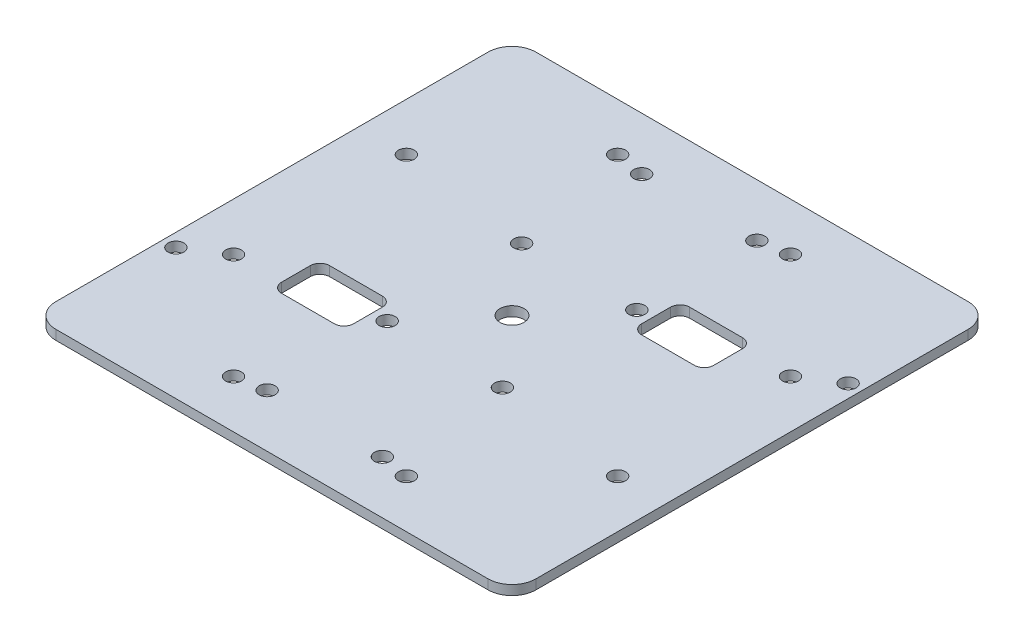
from build123d import *

# Parameters (mm, degrees)
SKETCH_1_W               = 100
SKETCH_1_H               = 100
EXTRUDE_1_DEPTH          = 2
CUT_EXTRUDE_436_REACH    = 72.739
SKETCH_2_R               = 2.5
CUT_EXTRUDE_2_REACH      = 72.739
SKETCH_3_R               = 1.65
PATTERN_LINEAR_1_COUNT   = 2
PATTERN_LINEAR_1_PITCH   = 25
MIRROR_1_COPY_1_REACH    = 72.739
MIRROR_1_COPY_1_SKETCH_R = 1.65
CUT_EXTRUDE_3_REACH      = 72.739
SKETCH_5_R               = 1.65
PATTERN_CIRCULAR_1_COUNT = 2
CUT_EXTRUDE_4_REACH      = 72.739
SKETCH_6_R               = 1.65
PATTERN_CIRCULAR_2_COUNT = 2
PATTERN_CIRCULAR_2_ANGLE = 90
CUT_EXTRUDE_5_REACH      = 72.739
SKETCH_7_W               = 15
SKETCH_7_H               = 10
FILLET_1_R               = 2
FILLET_2_R               = 5


with BuildPart() as part:
    # 草图1 → 凸台-拉伸1 (new body)
    with BuildSketch(Plane(origin=(0, 0, 0), x_dir=(1, 0, 0), z_dir=(0, 1, 0))):
        Rectangle(SKETCH_1_W, SKETCH_1_H)
    extrude(amount=EXTRUDE_1_DEPTH)

    # 草图2 → Cut-Extrude 436 (cut, up to next)
    with BuildSketch(Plane(origin=(0, 2, 0), x_dir=(1, 0, 0), z_dir=(0, 1, 0)), mode=Mode.PRIVATE) as cut_extrude_436_sk1:
        with Locations(Location((0, 0, 0), (0, 0, 270))):
            Circle(SKETCH_2_R)
    cut_extrude_436_tool1 = extrude(cut_extrude_436_sk1.sketch, amount=-CUT_EXTRUDE_436_REACH, mode=Mode.PRIVATE) & part.part
    add(cut_extrude_436_tool1.solids().sort_by_distance((0, 2, 0))[0], mode=Mode.SUBTRACT)

    # 草图3 → 切除-拉伸2 (cut, up to next)
    with BuildSketch(Plane(origin=(0, 2, 0), x_dir=(1, 0, 0), z_dir=(0, 1, 0)), mode=Mode.PRIVATE) as cut_extrude_2_sk1:
        with Locations(Location((-12, 39, 0), (0, 0, 270))):
            Circle(SKETCH_3_R)
    cut_extrude_2_tool1 = extrude(cut_extrude_2_sk1.sketch, amount=-CUT_EXTRUDE_2_REACH, mode=Mode.PRIVATE) & part.part
    # 草图3 → 切除-拉伸2 (cut, up to next)
    with BuildSketch(Plane(origin=(0, 2, 0), x_dir=(1, 0, 0), z_dir=(0, 1, 0)), mode=Mode.PRIVATE) as cut_extrude_2_sk2:
        with Locations(Location((12, 39, 0), (0, 0, 270))):
            Circle(SKETCH_3_R)
    cut_extrude_2_tool2 = extrude(cut_extrude_2_sk2.sketch, amount=-CUT_EXTRUDE_2_REACH, mode=Mode.PRIVATE) & part.part
    cut_extrude_2_1 = cut_extrude_2_tool1.solids().sort_by_distance((-12, 2, -39))[0]
    add(cut_extrude_2_1, mode=Mode.SUBTRACT)
    cut_extrude_2_2 = cut_extrude_2_tool2.solids().sort_by_distance((12, 2, -39))[0]
    add(cut_extrude_2_2, mode=Mode.SUBTRACT)
    cut_extrude_2 = cut_extrude_2_1 + cut_extrude_2_2  # 切除-拉伸2 as one shape, for the pattern or mirror that repeats it

    # 阵列(线性)1: 切除-拉伸2 ×2
    with Locations(*[(0, 0, i * PATTERN_LINEAR_1_PITCH) for i in range(1, PATTERN_LINEAR_1_COUNT)]):
        add(cut_extrude_2, mode=Mode.SUBTRACT)

    # 镜向1: 切除-拉伸2 across plane
    add(cut_extrude_2.mirror(Plane.XY), mode=Mode.SUBTRACT)

    # 镜向1 copy 1 sketch → 镜向1 copy 1 (cut, up to next)
    with BuildSketch(Plane(origin=(0, 2, -25), x_dir=(1, 0, 0), z_dir=(0, 1, 0)), mode=Mode.PRIVATE) as mirror_1_copy_1_sk1:
        with Locations((-12, -39)):
            Circle(MIRROR_1_COPY_1_SKETCH_R)
    mirror_1_copy_1_tool1 = extrude(mirror_1_copy_1_sk1.sketch, amount=-MIRROR_1_COPY_1_REACH, mode=Mode.PRIVATE) & part.part
    # 镜向1 copy 1 sketch → 镜向1 copy 1 (cut, up to next)
    with BuildSketch(Plane(origin=(0, 2, -25), x_dir=(1, 0, 0), z_dir=(0, 1, 0)), mode=Mode.PRIVATE) as mirror_1_copy_1_sk2:
        with Locations((12, -39)):
            Circle(MIRROR_1_COPY_1_SKETCH_R)
    mirror_1_copy_1_tool2 = extrude(mirror_1_copy_1_sk2.sketch, amount=-MIRROR_1_COPY_1_REACH, mode=Mode.PRIVATE) & part.part
    add(mirror_1_copy_1_tool1.solids().sort_by_distance((-12, 2, 14))[0], mode=Mode.SUBTRACT)
    add(mirror_1_copy_1_tool2.solids().sort_by_distance((12, 2, 14))[0], mode=Mode.SUBTRACT)

    # 草图5 → 切除-拉伸3 (cut, up to next)
    with BuildSketch(Plane(origin=(0, 2, 0), x_dir=(1, 0, 0), z_dir=(0, 1, 0)), mode=Mode.PRIVATE) as cut_extrude_3_sk1:
        with Locations(Location((47.25, 22.75, 0), (0, 0, 270))):
            Circle(SKETCH_5_R)
    cut_extrude_3_tool1 = extrude(cut_extrude_3_sk1.sketch, amount=-CUT_EXTRUDE_3_REACH, mode=Mode.PRIVATE) & part.part
    cut_extrude_3 = cut_extrude_3_tool1.solids().sort_by_distance((47.25, 2, -22.75))[0]
    add(cut_extrude_3, mode=Mode.SUBTRACT)

    # 阵列(圆周)1: 切除-拉伸3 ×2 about axis
    pattern_circular_1_axis = Axis((0, 0, 0), (0, 1, 0))
    for i in range(1, PATTERN_CIRCULAR_1_COUNT):
        add(cut_extrude_3.rotate(pattern_circular_1_axis, i * 360 / PATTERN_CIRCULAR_1_COUNT), mode=Mode.SUBTRACT)

    # 草图6 → 切除-拉伸4 (cut, up to next)
    with BuildSketch(Plane(origin=(0, 2, 0), x_dir=(1, 0, 0), z_dir=(0, 1, 0)), mode=Mode.PRIVATE) as cut_extrude_4_sk1:
        with Locations(Location((-40, 18, 0), (0, 0, 270))):
            Circle(SKETCH_6_R)
    cut_extrude_4_tool1 = extrude(cut_extrude_4_sk1.sketch, amount=-CUT_EXTRUDE_4_REACH, mode=Mode.PRIVATE) & part.part
    # 草图6 → 切除-拉伸4 (cut, up to next)
    with BuildSketch(Plane(origin=(0, 2, 0), x_dir=(1, 0, 0), z_dir=(0, 1, 0)), mode=Mode.PRIVATE) as cut_extrude_4_sk2:
        with Locations(Location((-40, -18, 0), (0, 0, 270))):
            Circle(SKETCH_6_R)
    cut_extrude_4_tool2 = extrude(cut_extrude_4_sk2.sketch, amount=-CUT_EXTRUDE_4_REACH, mode=Mode.PRIVATE) & part.part
    # 草图6 → 切除-拉伸4 (cut, up to next)
    with BuildSketch(Plane(origin=(0, 2, 0), x_dir=(1, 0, 0), z_dir=(0, 1, 0)), mode=Mode.PRIVATE) as cut_extrude_4_sk3:
        with Locations(Location((40, -18, 0), (0, 0, 270))):
            Circle(SKETCH_6_R)
    cut_extrude_4_tool3 = extrude(cut_extrude_4_sk3.sketch, amount=-CUT_EXTRUDE_4_REACH, mode=Mode.PRIVATE) & part.part
    # 草图6 → 切除-拉伸4 (cut, up to next)
    with BuildSketch(Plane(origin=(0, 2, 0), x_dir=(1, 0, 0), z_dir=(0, 1, 0)), mode=Mode.PRIVATE) as cut_extrude_4_sk4:
        with Locations(Location((40, 18, 0), (0, 0, 270))):
            Circle(SKETCH_6_R)
    cut_extrude_4_tool4 = extrude(cut_extrude_4_sk4.sketch, amount=-CUT_EXTRUDE_4_REACH, mode=Mode.PRIVATE) & part.part
    cut_extrude_4_1 = cut_extrude_4_tool1.solids().sort_by_distance((-40, 2, -18))[0]
    add(cut_extrude_4_1, mode=Mode.SUBTRACT)
    cut_extrude_4_2 = cut_extrude_4_tool2.solids().sort_by_distance((-40, 2, 18))[0]
    add(cut_extrude_4_2, mode=Mode.SUBTRACT)
    cut_extrude_4_3 = cut_extrude_4_tool3.solids().sort_by_distance((40, 2, 18))[0]
    add(cut_extrude_4_3, mode=Mode.SUBTRACT)
    cut_extrude_4_4 = cut_extrude_4_tool4.solids().sort_by_distance((40, 2, -18))[0]
    add(cut_extrude_4_4, mode=Mode.SUBTRACT)
    cut_extrude_4 = cut_extrude_4_1 + cut_extrude_4_2 + cut_extrude_4_3 + cut_extrude_4_4  # 切除-拉伸4 as one shape, for the pattern or mirror that repeats it

    # 阵列(圆周)2: 切除-拉伸4 ×2 about axis
    pattern_circular_2_axis = Axis((0, 0, 0), (0, -1, 0))
    for i in range(1, PATTERN_CIRCULAR_2_COUNT):
        add(cut_extrude_4.rotate(pattern_circular_2_axis, i * PATTERN_CIRCULAR_2_ANGLE / (PATTERN_CIRCULAR_2_COUNT - 1)), mode=Mode.SUBTRACT)

    # 草图7 → 切除-拉伸5 (cut, up to next)
    with BuildSketch(Plane(origin=(0, 2, 0), x_dir=(1, 0, 0), z_dir=(0, 1, 0)), mode=Mode.PRIVATE) as cut_extrude_5_sk1:
        with Locations((-22.5, -15)):
            Rectangle(SKETCH_7_W, SKETCH_7_H)
    cut_extrude_5_tool1 = extrude(cut_extrude_5_sk1.sketch, amount=-CUT_EXTRUDE_5_REACH, mode=Mode.PRIVATE) & part.part
    # 草图7 → 切除-拉伸5 (cut, up to next)
    with BuildSketch(Plane(origin=(0, 2, 0), x_dir=(1, 0, 0), z_dir=(0, 1, 0)), mode=Mode.PRIVATE) as cut_extrude_5_sk2:
        with Locations((22.5, 15)):
            Rectangle(SKETCH_7_W, SKETCH_7_H)
    cut_extrude_5_tool2 = extrude(cut_extrude_5_sk2.sketch, amount=-CUT_EXTRUDE_5_REACH, mode=Mode.PRIVATE) & part.part
    add(cut_extrude_5_tool1.solids().sort_by_distance((-22.5, 2, 15))[0], mode=Mode.SUBTRACT)
    add(cut_extrude_5_tool2.solids().sort_by_distance((22.5, 2, -15))[0], mode=Mode.SUBTRACT)

    # 圆角1
    fillet_1_edges = [part.edges().sort_by_distance(p)[0] for p in [
        (15, 1, -10),
        (15, 1, -20),
        (30, 1, -20),
        (30, 1, -10),
        (-15, 1, 10),
        (-15, 1, 20),
        (-30, 1, 20),
        (-30, 1, 10),
    ]]
    fillet(fillet_1_edges, radius=FILLET_1_R)

    # 圆角2
    fillet_2_edges = [part.edges().sort_by_distance(p)[0] for p in [
        (50, 1, 50),
        (-50, 1, 50),
        (-50, 1, -50),
        (50, 1, -50),
    ]]
    fillet(fillet_2_edges, radius=FILLET_2_R)


solid = part.part
